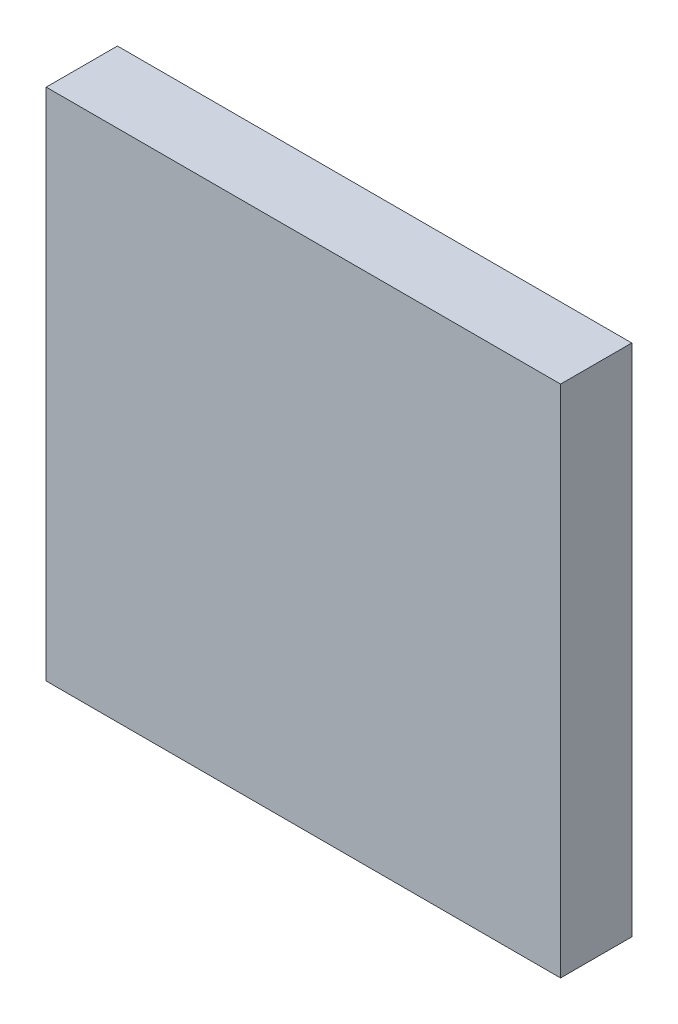
from build123d import *

# Parameters (mm, degrees)
SKETCH1_W           = 65
SKETCH1_H           = 65
BOSS_EXTRUDE1_DEPTH = 9


with BuildPart() as part:
    # Sketch1 → Boss-Extrude1 (new body)
    with BuildSketch(Plane.XY):
        Rectangle(SKETCH1_W, SKETCH1_H)
    extrude(amount=BOSS_EXTRUDE1_DEPTH)


solid = part.part
